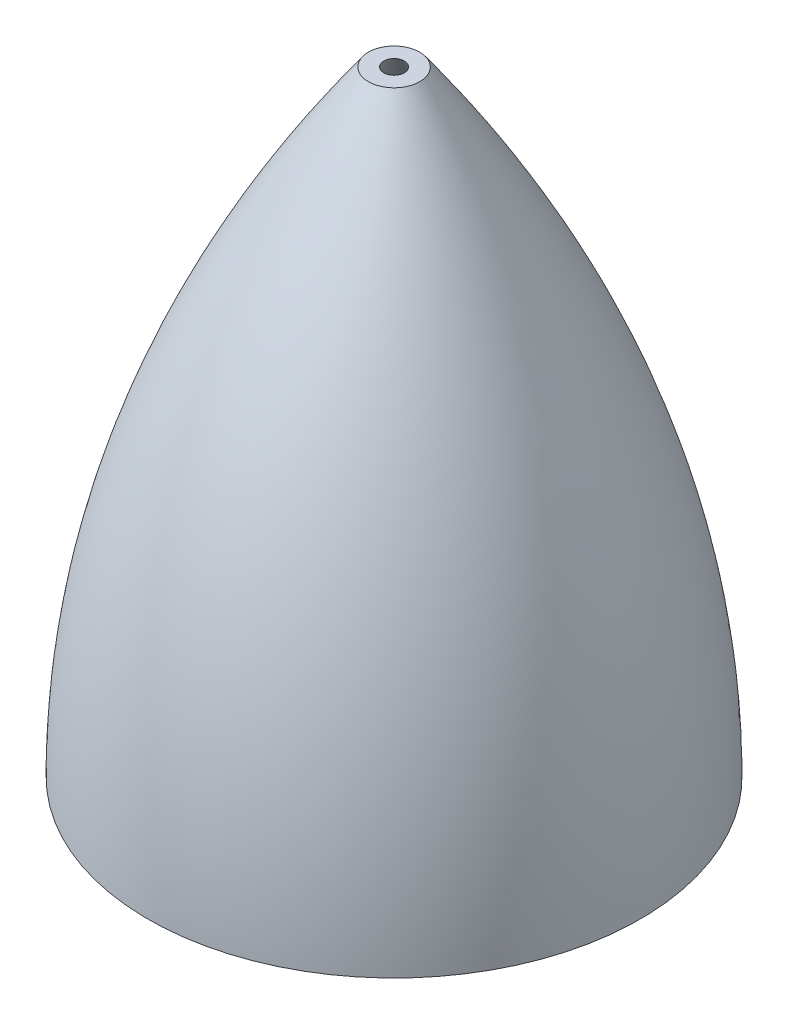
from build123d import *


with BuildPart() as part:
    # Sketch12 → Revolve9 (revolve)
    with BuildSketch(Plane.XY):
        with BuildLine():
            Line((5, 120), (2, 120))
            add(Edge.make_bspline(
                [(45, 0), (45, 60), (2, 120)],
                knots=[0, 0, 0, 1, 1, 1], degree=2))
            Line((45, 0), (48, 0))
            add(Edge.make_bspline(
                [(48, 0), (48, 60), (5, 120)],
                knots=[0, 0, 0, 1, 1, 1], degree=2))
        make_face()
    revolve(axis=Axis((0, 120, 0), (0, -1, 0)))


solid = part.part
